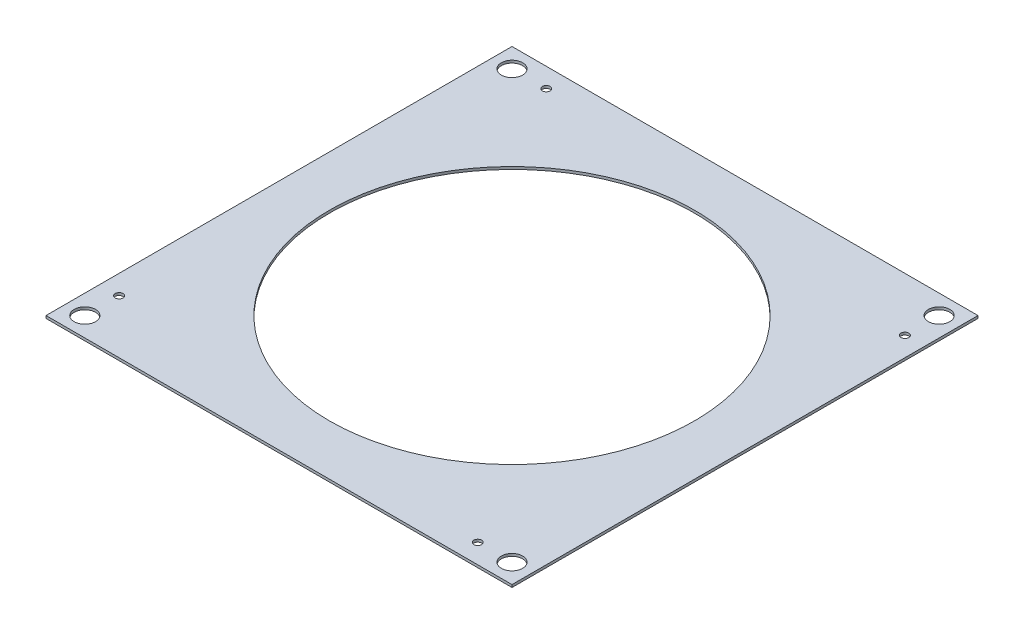
from build123d import *

# Parameters (mm, degrees)
SKETCH1_W           = 152.4
SKETCH1_H           = 152.4
SKETCH1_R           = 59.69
BOSS_EXTRUDE1_DEPTH = 0.4191
SKETCH2_R           = 3.4925
SKETCH2_R_2         = 1.27
CUT_EXTRUDE1_DEPTH  = 108.766333236
CIRPATTERN1_COUNT   = 4


with BuildPart() as part:
    # Sketch1 → Boss-Extrude1 (new, symmetric)
    with BuildSketch(Plane(origin=(0, 0, 0), x_dir=(1, 0, 0), z_dir=(0, 1, 0))):
        Rectangle(SKETCH1_W, SKETCH1_H)
        with Locations(Location((0, 0, 0), (0, 0, 270))):
            Circle(SKETCH1_R, mode=Mode.SUBTRACT)
    extrude(amount=BOSS_EXTRUDE1_DEPTH, both=True)

    # Sketch2 → Cut-Extrude1 (cut, through all)
    with BuildSketch(Plane(origin=(0, 0.4191, 0), x_dir=(1, 0, 0), z_dir=(0, 1, 0))):
        with Locations(Location((-69.85, 69.85, 0), (0, 0, 270))):
            Circle(SKETCH2_R)
        with Locations(Location((-58.647249233, 69.85, 0), (0, 0, 270))):
            Circle(SKETCH2_R_2)
    cut_extrude1 = extrude(amount=-CUT_EXTRUDE1_DEPTH, mode=Mode.SUBTRACT)

    # CirPattern1: Cut-Extrude1 ×4 about axis
    cirpattern1_axis = Axis((0, 0, 0), (0, 1, 0))
    for i in range(1, CIRPATTERN1_COUNT):
        add(cut_extrude1.rotate(cirpattern1_axis, i * 360 / CIRPATTERN1_COUNT), mode=Mode.SUBTRACT)


solid = part.part
